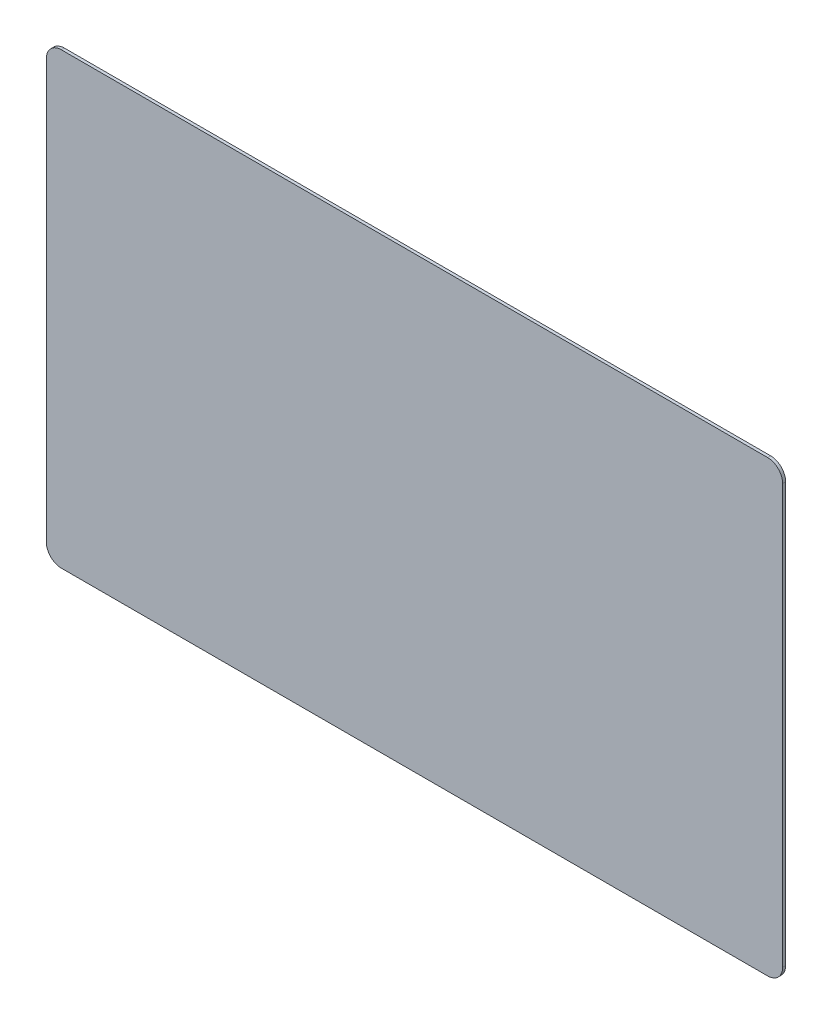
from build123d import *

# Parameters (mm, degrees)
SKETCH1_W           = 492
SKETCH1_H           = 300
BOSS_EXTRUDE1_DEPTH = 2
FILLET1_R           = 10


with BuildPart() as part:
    # Sketch1 → Boss-Extrude1 (new body)
    with BuildSketch(Plane.XY):
        with Locations((0, -584)):
            Rectangle(SKETCH1_W, SKETCH1_H)
    extrude(amount=BOSS_EXTRUDE1_DEPTH)

    # Fillet1
    fillet1_edges = [part.edges().sort_by_distance(p)[0] for p in [
        (-246, -734, 1),
        (-246, -434, 1),
        (246, -434, 1),
        (246, -734, 1),
    ]]
    fillet(fillet1_edges, radius=FILLET1_R)


solid = part.part
